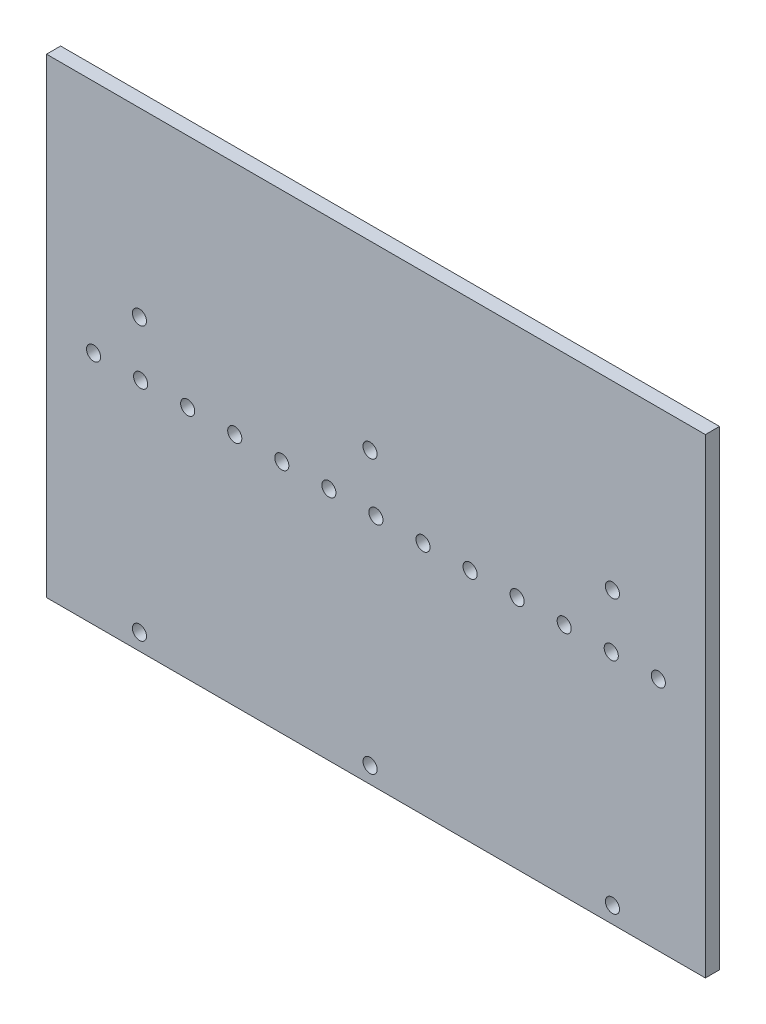
from build123d import *

# Parameters (mm, degrees)
SKETCH1_W           = 140
SKETCH1_H           = 100
BOSS_EXTRUDE1_DEPTH = 3
SKETCH2_R           = 1.5
CUT_EXTRUDE1_DEPTH  = 4
SKETCH3_R           = 1.5
CUT_EXTRUDE2_DEPTH  = 10


with BuildPart() as part:
    # Sketch1 → Boss-Extrude1 (new body)
    with BuildSketch(Plane.XY):
        Rectangle(SKETCH1_W, SKETCH1_H)
    extrude(amount=BOSS_EXTRUDE1_DEPTH)

    # Sketch2 → Cut-Extrude1 (cut)
    with BuildSketch(Plane.XY.offset(3)):
        Circle(SKETCH2_R)
        with Locations((10, 0)):
            Circle(SKETCH2_R)
        with Locations((20, 0)):
            Circle(SKETCH2_R)
        with Locations((30, 0)):
            Circle(SKETCH2_R)
        with Locations((40, 0)):
            Circle(SKETCH2_R)
        with Locations((50, 0)):
            Circle(SKETCH2_R)
        with Locations((60, 0)):
            Circle(SKETCH2_R)
        with Locations((-10, 0)):
            Circle(SKETCH2_R)
        with Locations((-20, 0)):
            Circle(SKETCH2_R)
        with Locations((-30, 0)):
            Circle(SKETCH2_R)
        with Locations((-40, 0)):
            Circle(SKETCH2_R)
        with Locations((-50, 0)):
            Circle(SKETCH2_R)
        with Locations((-60, 0)):
            Circle(SKETCH2_R)
    extrude(amount=-CUT_EXTRUDE1_DEPTH, mode=Mode.SUBTRACT)

    # Sketch3 → Cut-Extrude2 (cut)
    with BuildSketch(Plane.XY.offset(3)):
        with Locations((50.25, -46.5)):
            Circle(SKETCH3_R)
        with Locations((-50.25, -46.5)):
            Circle(SKETCH3_R)
        with Locations((-1.25, -46.5)):
            Circle(SKETCH3_R)
        with Locations((-1.25, 11.5)):
            Circle(SKETCH3_R)
        with Locations((50.25, 11.5)):
            Circle(SKETCH3_R)
        with Locations((-50.25, 11.5)):
            Circle(SKETCH3_R)
    extrude(amount=-CUT_EXTRUDE2_DEPTH, mode=Mode.SUBTRACT)


solid = part.part
